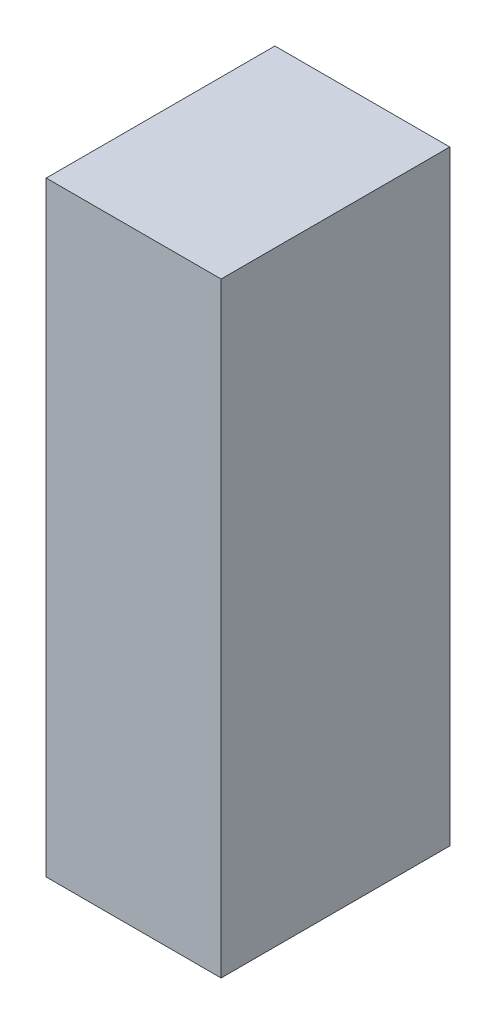
from build123d import *

# Parameters (mm, degrees)
SKETCH_1_W      = 13
SKETCH_1_H      = 45
EXTRUDE_1_DEPTH = 17


with BuildPart() as part:
    # 草圖1 → 填料-伸長1 (new body)
    with BuildSketch(Plane.XY):
        Rectangle(SKETCH_1_W, SKETCH_1_H)
    extrude(amount=EXTRUDE_1_DEPTH)


solid = part.part
